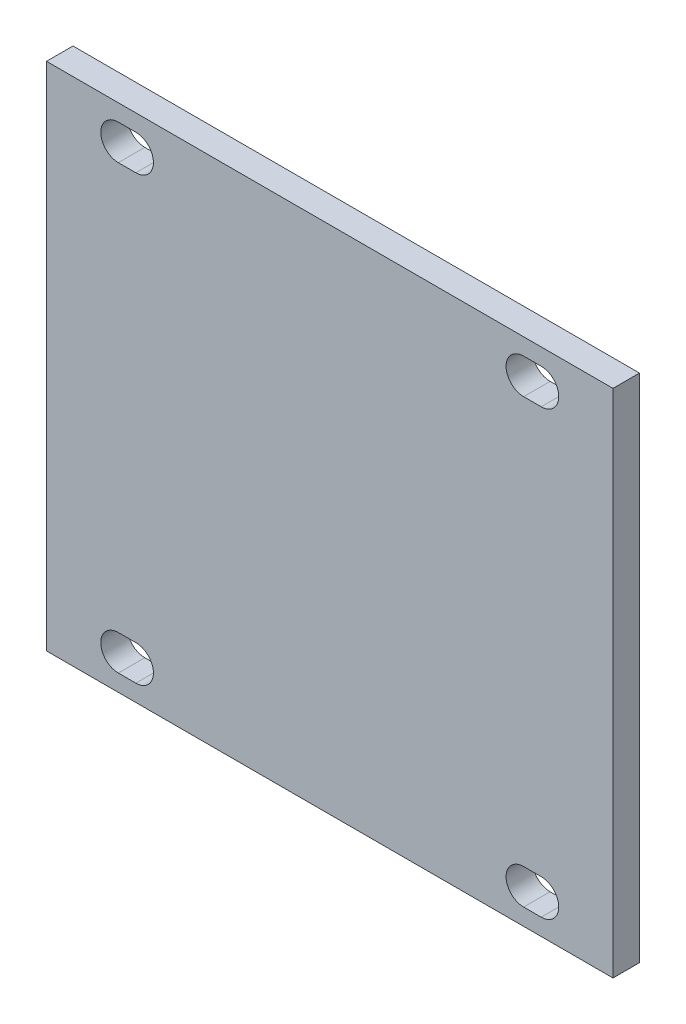
from build123d import *

# Parameters (mm, degrees)
SKETCH1_W           = 35.5
SKETCH1_H           = 32
BOSS_EXTRUDE1_DEPTH = 1.66
SKETCH2_W           = 31.32
SKETCH2_H           = 15.62
BOSS_EXTRUDE2_DEPTH = 1


with BuildPart() as part:
    # Sketch1 → Boss-Extrude1 (new body)
    with BuildSketch(Plane.XY):
        with Locations((17.75, 16)):
            Rectangle(SKETCH1_W, SKETCH1_H)
        with BuildLine():
            Line((4.5, 30.95), (5.6, 30.95))
            ThreePointArc((5.6, 30.95), (6.7, 29.85), (5.6, 28.75))
            Line((5.6, 28.75), (4.5, 28.75))
            ThreePointArc((4.5, 28.75), (3.4, 29.85), (4.5, 30.95))
        make_face(mode=Mode.SUBTRACT)
        with BuildLine():
            Line((29.9, 28.75), (31, 28.75))
            ThreePointArc((31, 28.75), (32.1, 29.85), (31, 30.95))
            Line((31, 30.95), (29.9, 30.95))
            ThreePointArc((29.9, 30.95), (28.8, 29.85), (29.9, 28.75))
        make_face(mode=Mode.SUBTRACT)
        with BuildLine():
            Line((29.9, 1.05), (31, 1.05))
            ThreePointArc((31, 1.05), (32.1, 2.15), (31, 3.25))
            Line((31, 3.25), (29.9, 3.25))
            ThreePointArc((29.9, 3.25), (28.8, 2.15), (29.9, 1.05))
        make_face(mode=Mode.SUBTRACT)
        with BuildLine():
            Line((4.5, 1.05), (5.6, 1.05))
            ThreePointArc((5.6, 1.05), (6.7, 2.15), (5.6, 3.25))
            Line((5.6, 3.25), (4.5, 3.25))
            ThreePointArc((4.5, 3.25), (3.4, 2.15), (4.5, 1.05))
        make_face(mode=Mode.SUBTRACT)
    extrude(amount=BOSS_EXTRUDE1_DEPTH)

    # Sketch2 → Boss-Extrude2 (add)
    with BuildSketch(Plane.XY):
        with Locations((17.75, 18.05)):
            Rectangle(SKETCH2_W, SKETCH2_H)
    extrude(amount=-BOSS_EXTRUDE2_DEPTH)


solid = part.part
